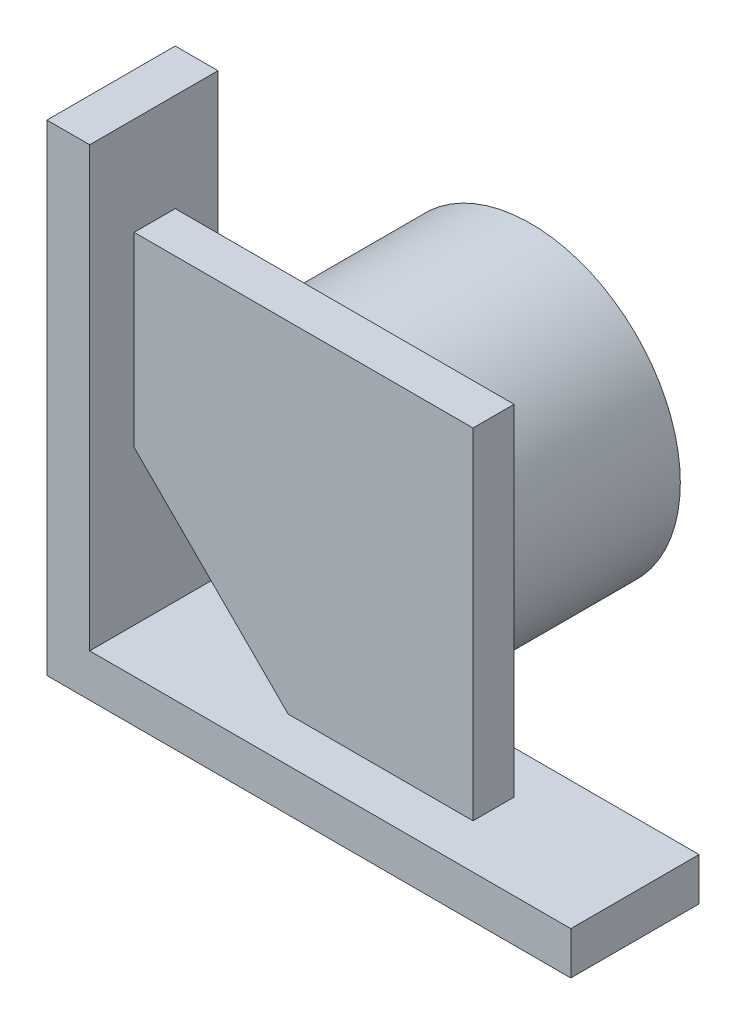
from build123d import *

# Parameters (mm, degrees)
SKETCH1_W           = 12.7
SKETCH1_H           = 38.1
BOSS_EXTRUDE1_DEPTH = 155.575
SKETCH3_W           = 12.7
SKETCH3_H           = 38.1
BOSS_EXTRUDE2_DEPTH = 130.175
SKETCH4_W           = 100.6348
SKETCH4_H           = 12.192
BOSS_EXTRUDE3_DEPTH = 101.0412
CUT_EXTRUDE2_DEPTH  = 12.192
BOSS_EXTRUDE8_START = 61.0616
SKETCH6_R           = 44.45
SKETCH6_R_2         = 39.3192
BOSS_EXTRUDE8_DEPTH = 61.0616


with BuildPart() as part:
    # Sketch1 → Boss-Extrude1 (new body)
    with BuildSketch(Plane(origin=(0, 0, 0), x_dir=(0, -1, 0), z_dir=(-1, 0, 0))):
        with Locations((-6.35, 19.05)):
            Rectangle(SKETCH1_W, SKETCH1_H)
    extrude(amount=-BOSS_EXTRUDE1_DEPTH)

    # Sketch3 → Boss-Extrude2 (add)
    with BuildSketch(Plane(origin=(0, 12.7, 0), x_dir=(1, 0, 0), z_dir=(0, 1, 0))):
        with Locations((6.35, -19.05)):
            Rectangle(SKETCH3_W, SKETCH3_H)
    extrude(amount=BOSS_EXTRUDE2_DEPTH)

    # Sketch4 → Boss-Extrude3 (add)
    with BuildSketch(Plane(origin=(0, 12.7, 0), x_dir=(1, 0, 0), z_dir=(0, 1, 0))):
        with Locations((63.0174, -18.796)):
            Rectangle(SKETCH4_W, SKETCH4_H)
    extrude(amount=BOSS_EXTRUDE3_DEPTH)

    # Sketch5 → Cut-Extrude2 (cut)
    with BuildSketch(Plane.XY.offset(24.892)):
        Polygon((12.7, 58.42), (58.42, 12.7), (12.7, 12.7), align=None)
    extrude(amount=-CUT_EXTRUDE2_DEPTH, mode=Mode.SUBTRACT)

    # Sketch6 → Boss-Extrude8 (add)
    with BuildSketch(Plane(origin=(0, 0, 12.7), x_dir=(-1, 0, 0), z_dir=(0, 0, -1)).offset(BOSS_EXTRUDE8_START)):
        with Locations(Location((-57.2008, 57.2008, 0), (0, 0, 1.486934097))):
            Circle(SKETCH6_R)
        with Locations(Location((-57.2008, 57.2008, 0), (0, 0, 180))):
            Circle(SKETCH6_R_2, mode=Mode.SUBTRACT)
    extrude(amount=-BOSS_EXTRUDE8_DEPTH)


solid = part.part
